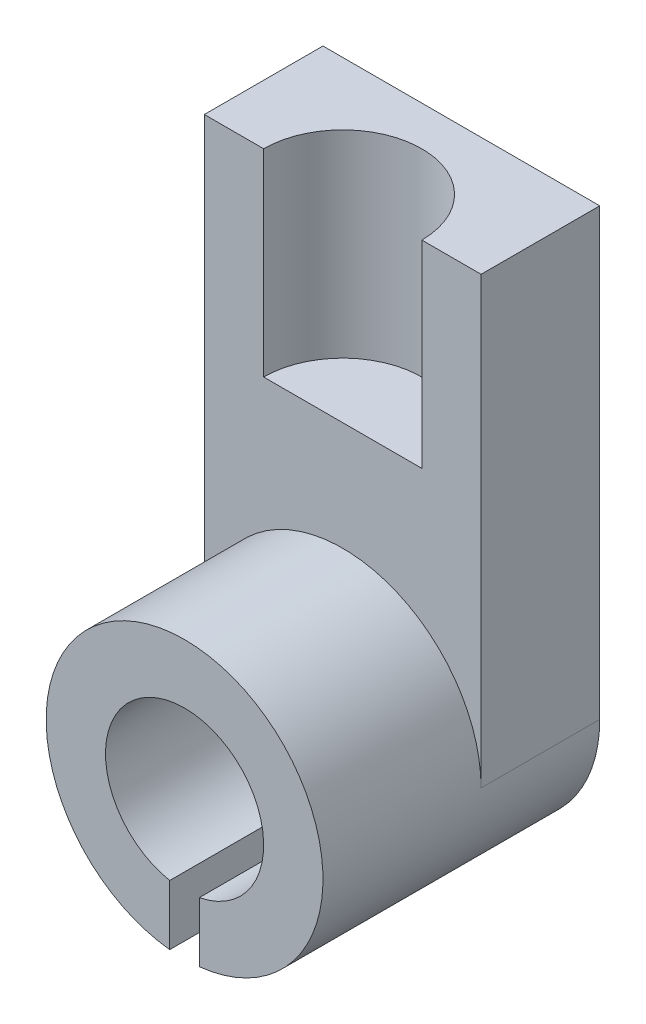
from build123d import *

# Parameters (mm, degrees)
BOSS_EXTRUDE1_DEPTH      = 56
BOSS_EXTRUDE2_REACH      = 135.439
BOSS_EXTRUDE2_END_RADIUS = 28
SKETCH2_W                = 56
SKETCH2_H                = 24
CUT_EXTRUDE1_DEPTH       = 40


with BuildPart() as part:
    # Sketch1 → Boss-Extrude1 (new body)
    with BuildSketch(Plane.XY):
        with BuildLine():
            Line((-3, -27.838821814), (-3, -15.716233646))
            ThreePointArc((-3, -15.716233646), (0, 16), (3, -15.716233646))
            Line((3, -15.716233646), (3, -27.838821814))
            ThreePointArc((3, -27.838821814), (0, 28), (-3, -27.838821814))
        make_face()
    extrude(amount=BOSS_EXTRUDE1_DEPTH)

    # Boss-Extrude2: up to this cylinder (the profile starts outside it)
    boss_extrude2_end = Plane(origin=(0, 0, 12), z_dir=(0, 0, -1)) * Cylinder(BOSS_EXTRUDE2_END_RADIUS, 327.878, mode=Mode.PRIVATE)
    # Sketch2 → Boss-Extrude2 (add, up to the surface)
    with BuildSketch(Plane(origin=(0, 90, 0), x_dir=(1, 0, 0), z_dir=(0, 1, 0)), mode=Mode.PRIVATE) as boss_extrude2_sk1:
        with Locations((0, -12)):
            Rectangle(SKETCH2_W, SKETCH2_H)
    boss_extrude2_tool1 = extrude(boss_extrude2_sk1.sketch, amount=-BOSS_EXTRUDE2_REACH, mode=Mode.PRIVATE) - boss_extrude2_end
    add(boss_extrude2_tool1.solids().sort_by_distance((0, 90, 12))[0])

    # Sketch3 → Cut-Extrude1 (cut)
    with BuildSketch(Plane(origin=(0, 90, 0), x_dir=(1, 0, 0), z_dir=(0, 1, 0))):
        with BuildLine():
            ThreePointArc((16, -24), (0, -8), (-16, -24))
            Line((-16, -24), (16, -24))
        make_face()
        with BuildLine():
            Line((16, -24), (-16, -24))
            ThreePointArc((-16, -24), (0, -40), (16, -24))
        make_face()
    extrude(amount=-CUT_EXTRUDE1_DEPTH, mode=Mode.SUBTRACT)


solid = part.part
